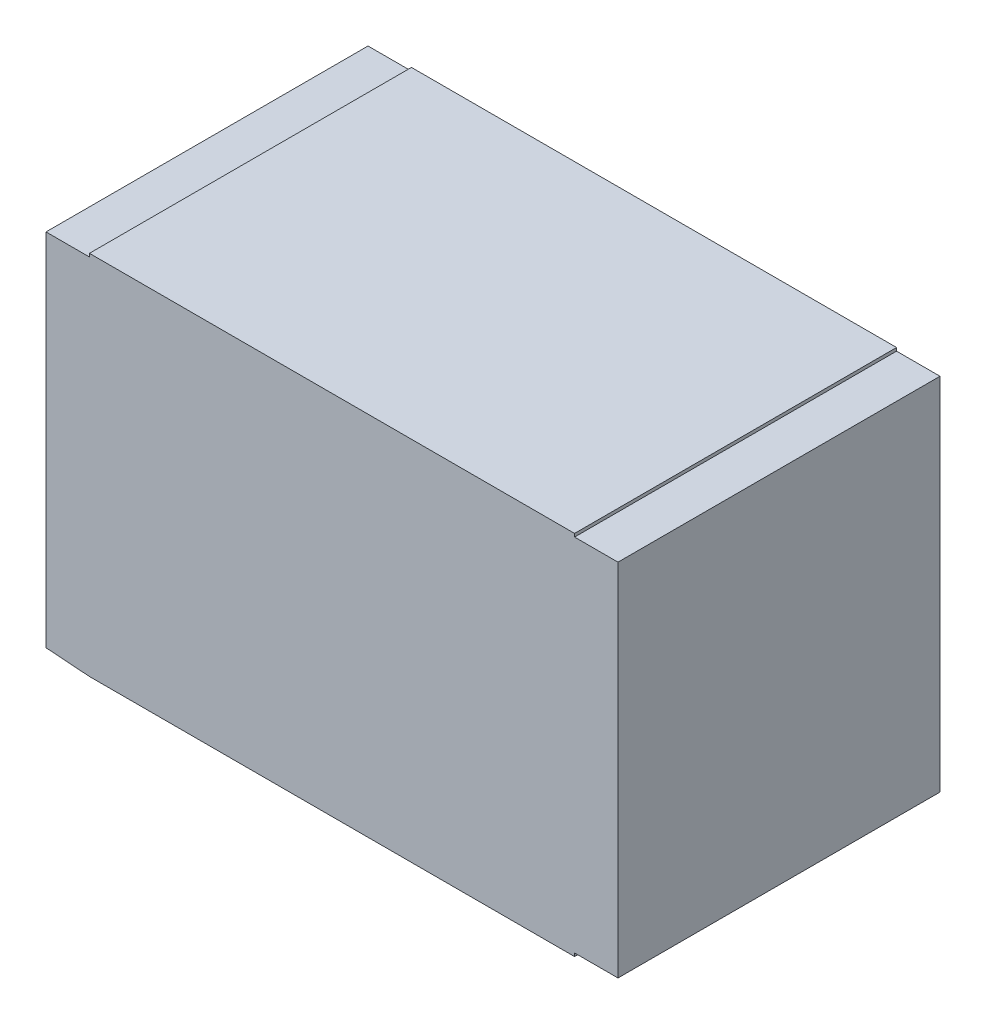
from build123d import *

# Parameters (mm, degrees)
COMPONENT_OUTLINE_DEPTH = 1.52


with BuildPart() as part:
    # 草图1 → Component_Outline (new body)
    with BuildSketch(Plane.XY):
        Polygon((-1.35, 0.85), (-1.145, 0.85), (-1.145, 0.865), (1.145, 0.865), (1.145, 0.85), (1.35, 0.85), (1.35, -0.85), (1.145, -0.85), (1.145, -0.865), (-1.145, -0.865), (-1.35, -0.85), align=None)
    extrude(amount=COMPONENT_OUTLINE_DEPTH)


solid = part.part
